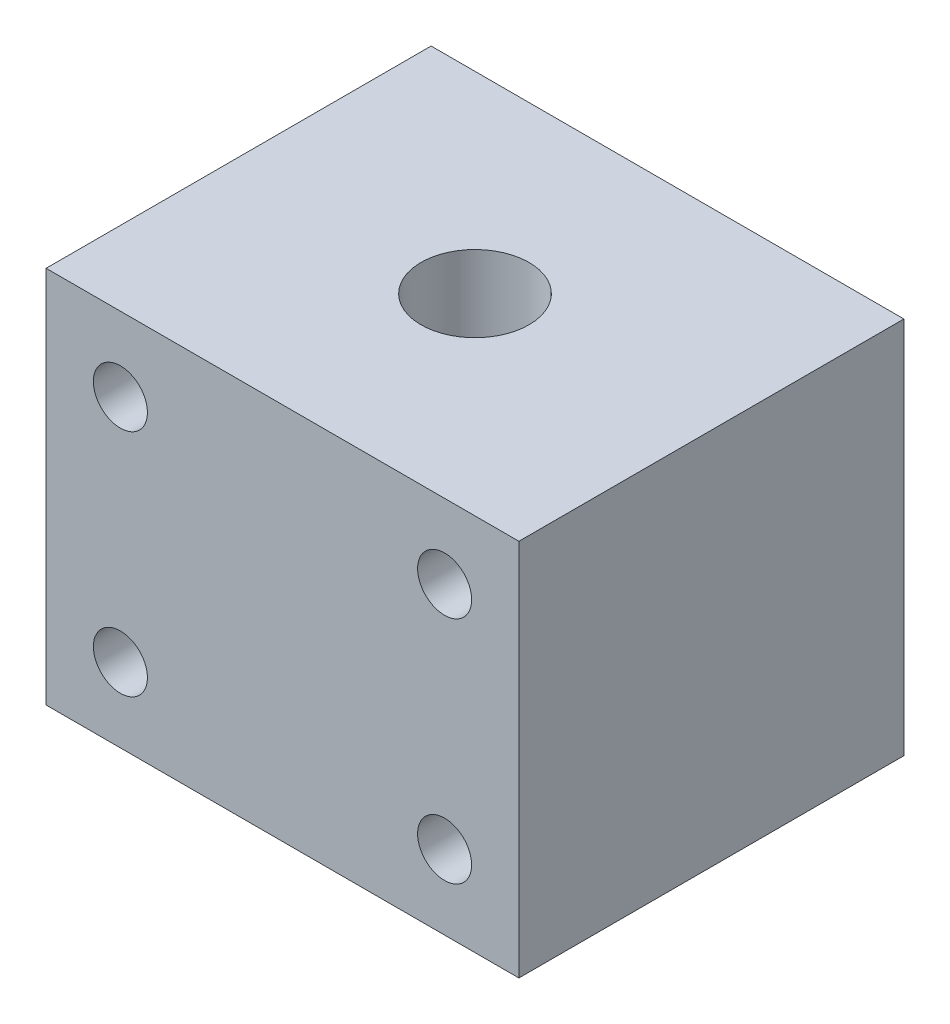
from build123d import *

# Parameters (mm, degrees)
SKETCH1_W           = 35
SKETCH1_H           = 28
SKETCH1_R           = 2
BOSS_EXTRUDE1_DEPTH = 28.5
SKETCH2_R           = 4
CUT_EXTRUDE1_DEPTH  = 54.115440316


with BuildPart() as part:
    # Sketch1 → Boss-Extrude1 (new body)
    with BuildSketch(Plane.XY):
        with Locations((17.5, 14)):
            Rectangle(SKETCH1_W, SKETCH1_H)
        with Locations(Location((5.5, 22.5, 0), (0, 0, 180))):
            Circle(SKETCH1_R, mode=Mode.SUBTRACT)
        with Locations(Location((29.5, 22.5, 0), (0, 0, 180))):
            Circle(SKETCH1_R, mode=Mode.SUBTRACT)
        with Locations(Location((5.5, 5.5, 0), (0, 0, 180))):
            Circle(SKETCH1_R, mode=Mode.SUBTRACT)
        with Locations(Location((29.5, 5.5, 0), (0, 0, 180))):
            Circle(SKETCH1_R, mode=Mode.SUBTRACT)
    extrude(amount=BOSS_EXTRUDE1_DEPTH)

    # Sketch2 → Cut-Extrude1 (cut, through all)
    with BuildSketch(Plane.XZ):
        with Locations((17.5, 14.25)):
            Circle(SKETCH2_R)
    extrude(amount=-CUT_EXTRUDE1_DEPTH, mode=Mode.SUBTRACT)


solid = part.part
